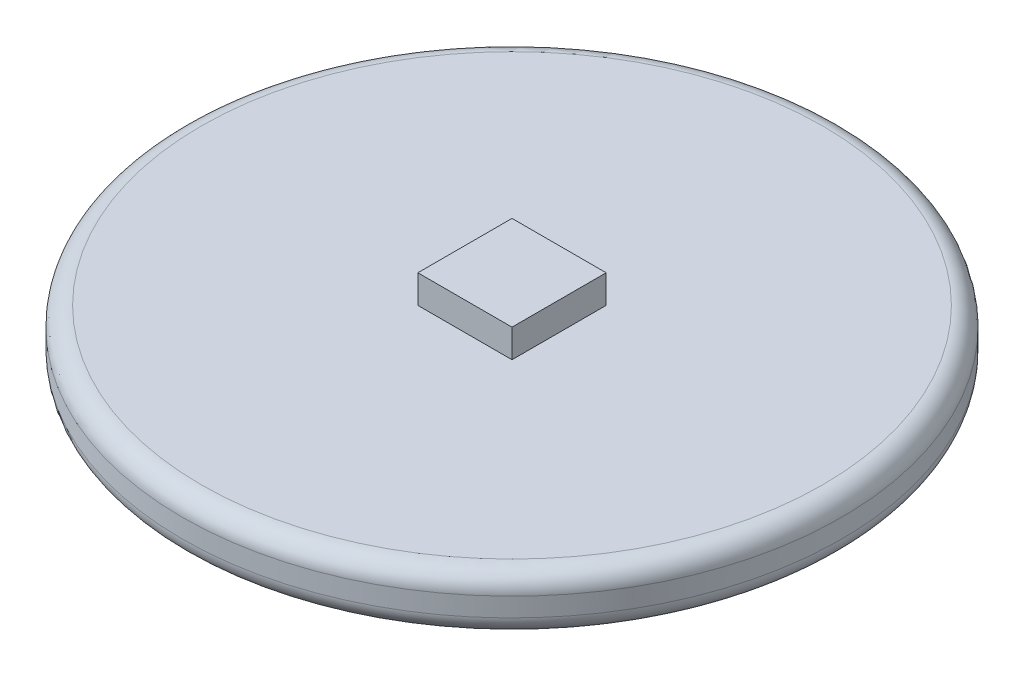
from build123d import *

# Parameters (mm, degrees)
SKETCH1_R           = 35
BOSS_EXTRUDE1_DEPTH = 6
FILLET2_R           = 2
SKETCH3_W           = 10
SKETCH3_H           = 10
BOSS_EXTRUDE3_DEPTH = 3


with BuildPart() as part:
    # Sketch1 → Boss-Extrude1 (new body)
    with BuildSketch(Plane(origin=(0, 0, 0), x_dir=(1, 0, 0), z_dir=(0, 1, 0))):
        with Locations(Location((0, 0, 0), (0, 0, 270))):
            Circle(SKETCH1_R)
    extrude(amount=BOSS_EXTRUDE1_DEPTH)

    # Fillet2
    fillet2_edges = [part.edges().sort_by_distance(p)[0] for p in [
        (0, 0, -35),
        (0, 6, -35),
    ]]
    fillet(fillet2_edges, radius=FILLET2_R)

    # Sketch3 → Boss-Extrude3 (add)
    with BuildSketch(Plane(origin=(0, 6, 0), x_dir=(1, 0, 0), z_dir=(0, 1, 0))):
        Rectangle(SKETCH3_W, SKETCH3_H)
    extrude(amount=BOSS_EXTRUDE3_DEPTH)


solid = part.part
